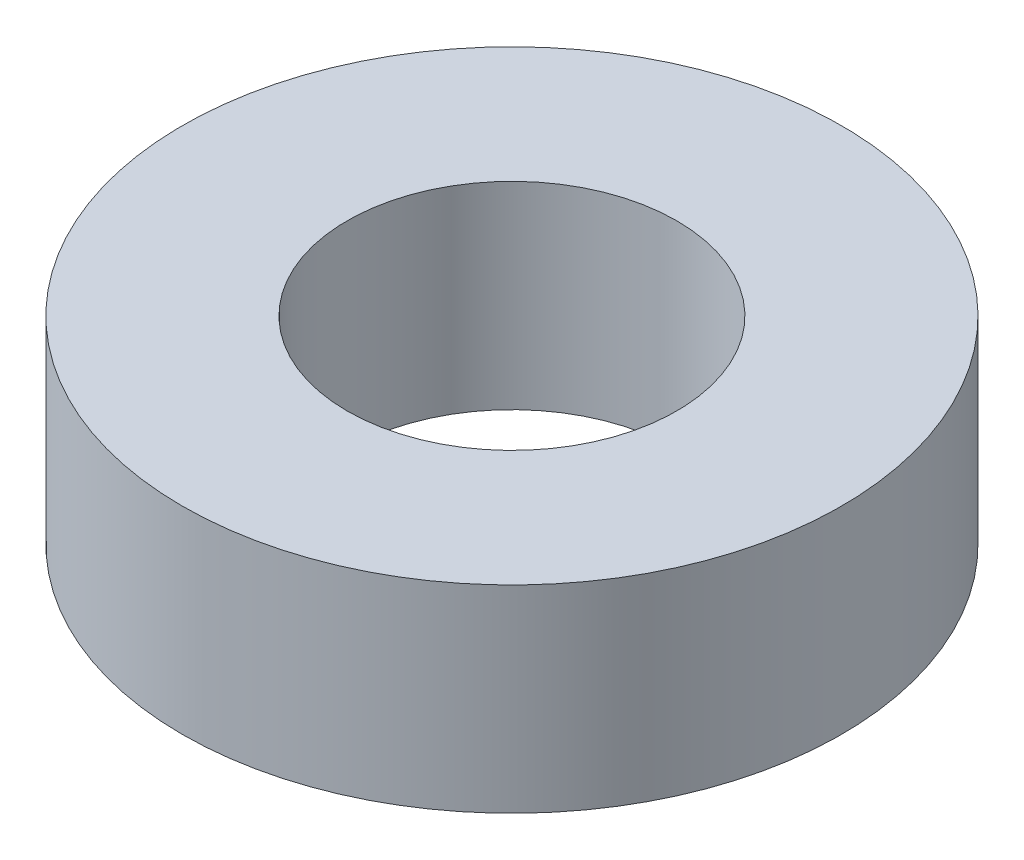
from build123d import *

# Parameters (mm, degrees)
SKETCH1_R           = 10
SKETCH1_R_2         = 5
BOSS_EXTRUDE1_DEPTH = 6


with BuildPart() as part:
    # Sketch1 → Boss-Extrude1 (new body)
    with BuildSketch(Plane(origin=(0, 0, 0), x_dir=(1, 0, 0), z_dir=(0, 1, 0))):
        Circle(SKETCH1_R)
        Circle(SKETCH1_R_2, mode=Mode.SUBTRACT)
    extrude(amount=BOSS_EXTRUDE1_DEPTH)


solid = part.part
